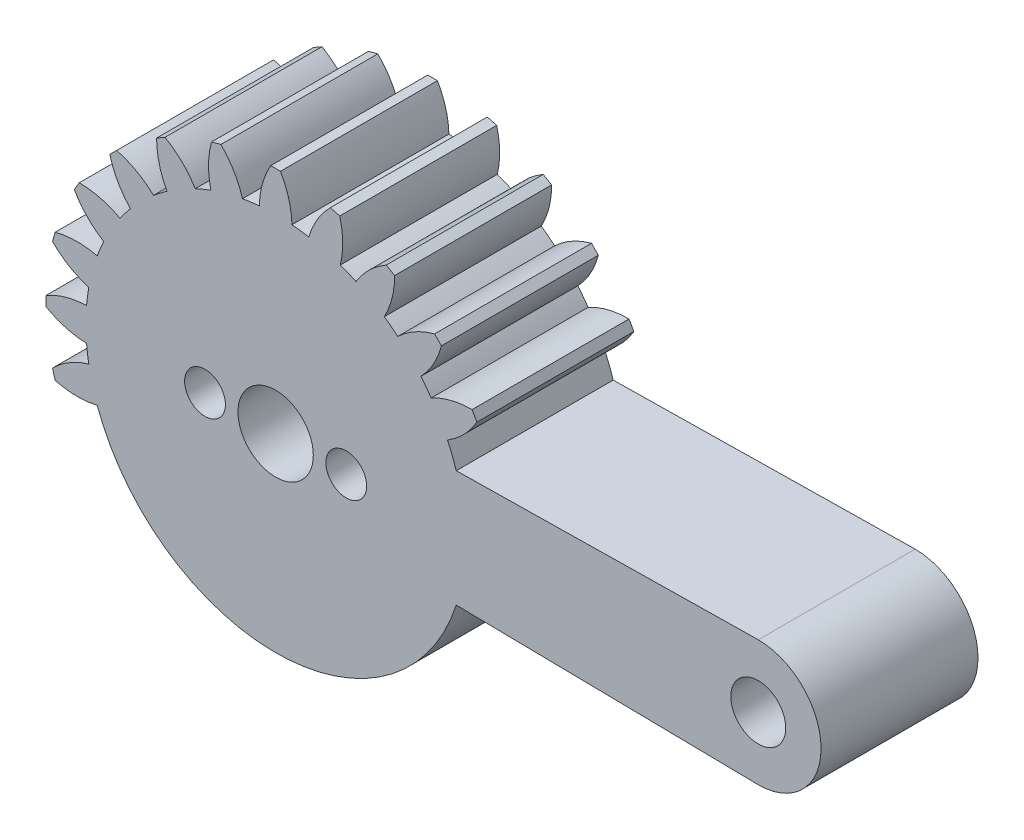
from build123d import *

# Parameters (mm, degrees)
SKETCH1_R           = 12.09
SKETCH1_R_2         = 1.75
BOSS_EXTRUDE1_DEPTH = 10
SKETCH2_R           = 2.4
SKETCH2_R_2         = 1.3
CUT_EXTRUDE1_DEPTH  = 40.007683858


with BuildPart() as part:
    # Sketch1 → Boss-Extrude1 (new body)
    # profile 1 of 17: a face of its own
    with BuildSketch(Plane.XY):
        Circle(SKETCH1_R)
        Circle(SKETCH1_R_2, mode=Mode.SUBTRACT)
    # profile 2 of 17: a face of its own
    with BuildSketch(Plane.XY):
        with BuildLine():
            Line((30.75, 4), (14.142164609, 3.746702505))
            Line((14.142164609, 3.746702505), (14.211728743, 3.487085624))
            ThreePointArc((14.211728743, 3.487085624), (13.144626757, 2.65424773), (11.903927815, 2.112960617))
            ThreePointArc((11.903927815, 2.112960617), (11.986568374, 1.578061664), (12.04518576, 1.04))
            ThreePointArc((12.04518576, 1.04), (13.383704325, 0.838273314), (14.63, 0.31))
            Line((14.63, 0.31), (14.63, -0.31))
            ThreePointArc((14.63, -0.31), (13.383704325, -0.838273314), (12.04518576, -1.04))
            ThreePointArc((12.04518576, -1.04), (11.986568374, -1.578061664), (11.903927815, -2.112960617))
            ThreePointArc((11.903927815, -2.112960617), (13.144626757, -2.65424773), (14.211728743, -3.487085624))
            Line((14.211728743, -3.487085624), (14.142164609, -3.746702505))
            Line((14.142164609, -3.746702505), (30.75, -4))
            ThreePointArc((30.75, -4), (34.75, 0), (30.75, 4))
        make_face()
        with Locations((30.75, 0)):
            Circle(SKETCH1_R_2, mode=Mode.SUBTRACT)
    # profile 3 of 17: a face of its own
    with BuildSketch(Plane.XY):
        with BuildLine():
            ThreePointArc((-11.365584201, -4.122086336), (-11.67804324, -3.129122255), (-11.903927815, -2.112960617))
            ThreePointArc((-11.903927815, -2.112960617), (-13.144626757, -2.65424773), (-14.211728743, -3.487085624))
            Line((-14.211728743, -3.487085624), (-14.051260935, -4.085959636))
            ThreePointArc((-14.051260935, -4.085959636), (-12.71070456, -4.273667417), (-11.365584201, -4.122086336))
        make_face()
    # profile 4 of 17: a face of its own
    with BuildSketch(Plane.XY):
        with BuildLine():
            ThreePointArc((-12.04518576, -1.04), (-12.09, 0), (-12.04518576, 1.04))
            ThreePointArc((-12.04518576, 1.04), (-13.383704325, 0.838273314), (-14.63, 0.31))
            Line((-14.63, 0.31), (-14.63, -0.31))
            ThreePointArc((-14.63, -0.31), (-13.383704325, -0.838273314), (-12.04518576, -1.04))
        make_face()
    # profile 5 of 17: a face of its own
    with BuildSketch(Plane.XY):
        with BuildLine():
            ThreePointArc((-11.903927815, 2.112960617), (-11.67804324, 3.129122255), (-11.365584201, 4.122086336))
            ThreePointArc((-11.365584201, 4.122086336), (-12.71070456, 4.273667417), (-14.051260935, 4.085959636))
            Line((-14.051260935, 4.085959636), (-14.211728743, 3.487085624))
            ThreePointArc((-14.211728743, 3.487085624), (-13.144626757, 2.65424773), (-11.903927815, 2.112960617))
        make_face()
    # profile 6 of 17: a face of its own
    with BuildSketch(Plane.XY):
        with BuildLine():
            ThreePointArc((-10.951436862, 5.12192646), (-10.470247132, 6.045), (-9.911436862, 6.9232593))
            ThreePointArc((-9.911436862, 6.9232593), (-11.171491285, 7.417818147), (-12.514951657, 7.583467875))
            Line((-12.514951657, 7.583467875), (-12.824951657, 7.046532125))
            ThreePointArc((-12.824951657, 7.046532125), (-12.009764599, 5.965886177), (-10.951436862, 5.12192646))
        make_face()
    # profile 7 of 17: a face of its own
    with BuildSketch(Plane.XY):
        with BuildLine():
            ThreePointArc((-9.252623584, 7.781841479), (-8.548920985, 8.548920985), (-7.781841479, 9.252623584))
            ThreePointArc((-7.781841479, 9.252623584), (-8.870959341, 10.05645683), (-10.125769107, 10.564175311))
            Line((-10.125769107, 10.564175311), (-10.564175311, 10.125769107))
            ThreePointArc((-10.564175311, 10.125769107), (-10.05645683, 8.870959341), (-9.252623584, 7.781841479))
        make_face()
    # profile 8 of 17: a face of its own
    with BuildSketch(Plane.XY):
        with BuildLine():
            ThreePointArc((-6.9232593, 9.911436862), (-6.045, 10.470247132), (-5.12192646, 10.951436862))
            ThreePointArc((-5.12192646, 10.951436862), (-5.965886177, 12.009764599), (-7.046532125, 12.824951657))
            Line((-7.046532125, 12.824951657), (-7.583467875, 12.514951657))
            ThreePointArc((-7.583467875, 12.514951657), (-7.417818147, 11.171491285), (-6.9232593, 9.911436862))
        make_face()
    # profile 9 of 17: a face of its own
    with BuildSketch(Plane.XY):
        with BuildLine():
            ThreePointArc((-4.122086336, 11.365584201), (-3.129122255, 11.67804324), (-2.112960617, 11.903927815))
            ThreePointArc((-2.112960617, 11.903927815), (-2.65424773, 13.144626757), (-3.487085624, 14.211728743))
            Line((-3.487085624, 14.211728743), (-4.085959636, 14.051260935))
            ThreePointArc((-4.085959636, 14.051260935), (-4.273667417, 12.71070456), (-4.122086336, 11.365584201))
        make_face()
    # profile 10 of 17: a face of its own
    with BuildSketch(Plane.XY):
        with BuildLine():
            Line((0.31, 14.63), (-0.31, 14.63))
            ThreePointArc((-0.31, 14.63), (-0.838273314, 13.383704325), (-1.04, 12.04518576))
            ThreePointArc((-1.04, 12.04518576), (0, 12.09), (1.04, 12.04518576))
            ThreePointArc((1.04, 12.04518576), (0.838273314, 13.383704325), (0.31, 14.63))
        make_face()
    # profile 11 of 17: a face of its own
    with BuildSketch(Plane.XY):
        with BuildLine():
            ThreePointArc((3.487085624, 14.211728743), (2.65424773, 13.144626757), (2.112960617, 11.903927815))
            ThreePointArc((2.112960617, 11.903927815), (3.129122255, 11.67804324), (4.122086336, 11.365584201))
            ThreePointArc((4.122086336, 11.365584201), (4.273667417, 12.71070456), (4.085959636, 14.051260935))
            Line((4.085959636, 14.051260935), (3.487085624, 14.211728743))
        make_face()
    # profile 12 of 17: a face of its own
    with BuildSketch(Plane.XY):
        with BuildLine():
            ThreePointArc((7.046532125, 12.824951657), (5.965886177, 12.009764599), (5.12192646, 10.951436862))
            ThreePointArc((5.12192646, 10.951436862), (6.045, 10.470247132), (6.9232593, 9.911436862))
            ThreePointArc((6.9232593, 9.911436862), (7.417818147, 11.171491285), (7.583467875, 12.514951657))
            Line((7.583467875, 12.514951657), (7.046532125, 12.824951657))
        make_face()
    # profile 13 of 17: a face of its own
    with BuildSketch(Plane.XY):
        with BuildLine():
            ThreePointArc((10.125769107, 10.564175311), (8.870959341, 10.05645683), (7.781841479, 9.252623584))
            ThreePointArc((7.781841479, 9.252623584), (8.548920985, 8.548920985), (9.252623584, 7.781841479))
            ThreePointArc((9.252623584, 7.781841479), (10.05645683, 8.870959341), (10.564175311, 10.125769107))
            Line((10.564175311, 10.125769107), (10.125769107, 10.564175311))
        make_face()
    # profile 14 of 17: a face of its own
    with BuildSketch(Plane.XY):
        with BuildLine():
            ThreePointArc((12.514951657, 7.583467875), (11.171491285, 7.417818147), (9.911436862, 6.9232593))
            ThreePointArc((9.911436862, 6.9232593), (10.470247132, 6.045), (10.951436862, 5.12192646))
            ThreePointArc((10.951436862, 5.12192646), (12.009764599, 5.965886177), (12.824951657, 7.046532125))
            Line((12.824951657, 7.046532125), (12.514951657, 7.583467875))
        make_face()
    # profile 15 of 17: a face of its own
    with BuildSketch(Plane.XY):
        with BuildLine():
            Line((14.142164609, 3.746702505), (11.507813792, 3.706524213))
            ThreePointArc((11.507813792, 3.706524213), (11.732956682, 2.916475184), (11.903927815, 2.112960617))
            ThreePointArc((11.903927815, 2.112960617), (13.144626757, 2.65424773), (14.211728743, 3.487085624))
            Line((14.211728743, 3.487085624), (14.142164609, 3.746702505))
        make_face()
    # profile 16 of 17: a face of its own
    with BuildSketch(Plane.XY):
        with BuildLine():
            ThreePointArc((14.63, 0.31), (13.383704325, 0.838273314), (12.04518576, 1.04))
            ThreePointArc((12.04518576, 1.04), (12.078791244, 0.520482544), (12.09, 0))
            ThreePointArc((12.09, 0), (12.078791244, -0.520482544), (12.04518576, -1.04))
            ThreePointArc((12.04518576, -1.04), (13.383704325, -0.838273314), (14.63, -0.31))
            Line((14.63, -0.31), (14.63, 0.31))
        make_face()
    # profile 17 of 17: a face of its own
    with BuildSketch(Plane.XY):
        with BuildLine():
            Line((11.507813792, -3.706524213), (14.142164609, -3.746702505))
            Line((14.142164609, -3.746702505), (14.211728743, -3.487085624))
            ThreePointArc((14.211728743, -3.487085624), (13.144626757, -2.65424773), (11.903927815, -2.112960617))
            ThreePointArc((11.903927815, -2.112960617), (11.732956682, -2.916475184), (11.507813792, -3.706524213))
        make_face()
    extrude(amount=BOSS_EXTRUDE1_DEPTH)

    # Sketch2 → Cut-Extrude1 (cut, through all)
    with BuildSketch(Plane.XY.offset(10)):
        Circle(SKETCH2_R)
        with Locations((4.5, 0)):
            Circle(SKETCH2_R_2)
        with Locations((-4.5, 0)):
            Circle(SKETCH2_R_2)
    extrude(amount=-CUT_EXTRUDE1_DEPTH, mode=Mode.SUBTRACT)


solid = part.part
